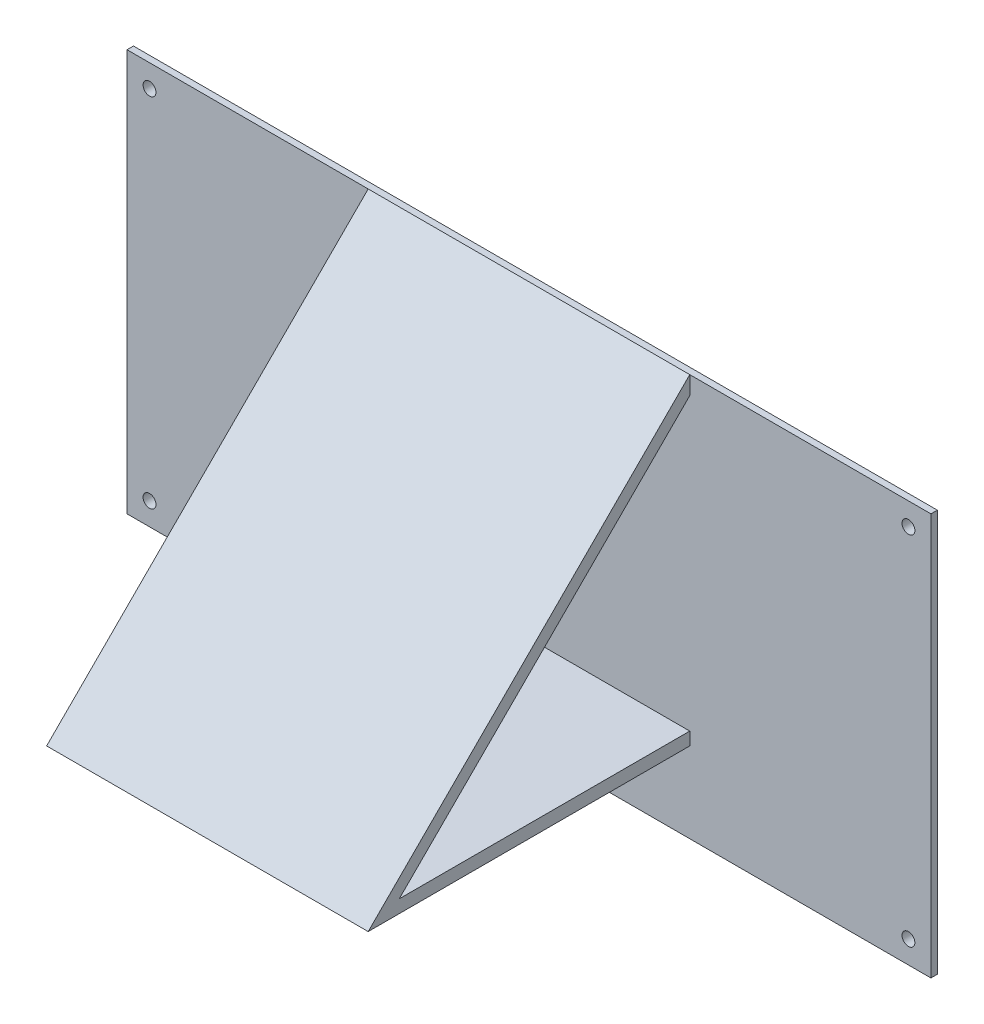
from build123d import *

# Parameters (mm, degrees)
SKIZZE1_W                       = 250
SKIZZE1_H                       = 125
AUFSATZ_LINEAR_AUSTRAGEN1_DEPTH = 2
SKIZZE2_W                       = 100
SKIZZE2_H                       = 100
AUFSATZ_LINEAR_AUSTRAGEN2_DEPTH = 100
SCHNITT_LINEAR_AUSTRAGEN1_DEPTH = 100
SCHNITT_LINEAR_AUSTRAGEN2_DEPTH = 100
SKIZZE6_W                       = 242
SKIZZE6_H                       = 117
AUFSATZ_LINEAR_AUSTRAGEN3_DEPTH = 2
SKIZZE7_R                       = 2
SCHNITT_LINEAR_AUSTRAGEN5_DEPTH = 32


with BuildPart() as part:
    # Skizze1 → Aufsatz-Linear austragen1 (new body)
    with BuildSketch(Plane.XY):
        with Locations((125, 62.5)):
            Rectangle(SKIZZE1_W, SKIZZE1_H)
    extrude(amount=AUFSATZ_LINEAR_AUSTRAGEN1_DEPTH)

    # Skizze2 → Aufsatz-Linear austragen2 (add)
    with BuildSketch(Plane.XY.offset(2)):
        with Locations((125, 75)):
            Rectangle(SKIZZE2_W, SKIZZE2_H)
    extrude(amount=AUFSATZ_LINEAR_AUSTRAGEN2_DEPTH)

    # Skizze3 → Schnitt-Linear austragen1 (cut)
    with BuildSketch(Plane.ZY.offset(-75)):
        Polygon((102, 25), (102, 125), (2, 125), align=None)
    extrude(amount=-SCHNITT_LINEAR_AUSTRAGEN1_DEPTH, mode=Mode.SUBTRACT)

    # Skizze4 → Schnitt-Linear austragen2 (cut)
    with BuildSketch(Plane.ZY.offset(-75)):
        Polygon((2, 119.343145751), (92.343145751, 29), (2, 29), align=None)
    extrude(amount=-SCHNITT_LINEAR_AUSTRAGEN2_DEPTH, mode=Mode.SUBTRACT)

    # Skizze6 → Aufsatz-Linear austragen3 (add)
    with BuildSketch(Plane(origin=(0, 0, 0), x_dir=(-1, 0, 0), z_dir=(0, 0, -1))):
        with Locations((-125, 62.5)):
            Rectangle(SKIZZE6_W, SKIZZE6_H)
    extrude(amount=AUFSATZ_LINEAR_AUSTRAGEN3_DEPTH)

    # Skizze7 → Schnitt-Linear austragen5 (cut)
    with BuildSketch(Plane(origin=(0, 0, -2), x_dir=(-1, 0, 0), z_dir=(0, 0, -1))):
        with Locations((-243, 118)):
            Circle(SKIZZE7_R)
        with Locations((-7, 7)):
            Circle(SKIZZE7_R)
        with Locations((-7, 118)):
            Circle(SKIZZE7_R)
        with Locations((-243, 7)):
            Circle(SKIZZE7_R)
    extrude(amount=-SCHNITT_LINEAR_AUSTRAGEN5_DEPTH, mode=Mode.SUBTRACT)


solid = part.part
